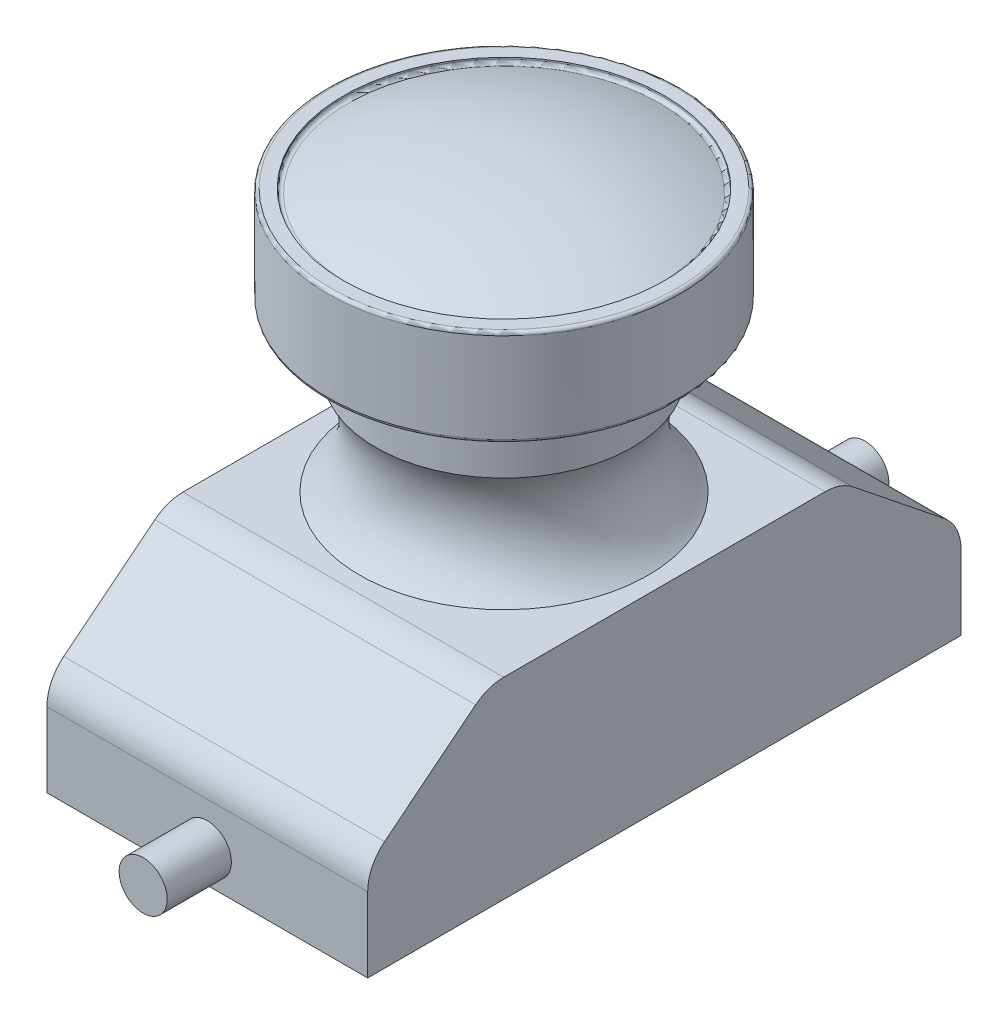
from build123d import *

# Parameters (mm, degrees)
BOSS_EXTRUDE1_DEPTH = 5
FILLET1_R           = 0.1
FILLET2_R           = 0.1
FILLET3_R           = 1.4
SKETCH4_R           = 0.75
BOSS_EXTRUDE2_DEPTH = 2


with BuildPart() as part:
    # Sketch1 → Boss-Extrude1 (new, symmetric)
    with BuildSketch(Plane(origin=(0, 0, 0), x_dir=(0, 0, -1), z_dir=(1, 0, 0))):
        Polygon((-9.25, 0), (9.25, 0), (9.25, 3), (5.5, 6), (-5.5, 6), (-9.25, 3), align=None)
    extrude(amount=BOSS_EXTRUDE1_DEPTH, both=True)

    # Sketch2 → Revolve1 (revolve)
    with BuildSketch(Plane(origin=(0, 0, 0), x_dir=(0, 0, -1), z_dir=(1, 0, 0))):
        with BuildLine():
            Line((0, 6), (0, 14))
            Line((0, 14), (5, 14))
            Line((5, 14), (5, 14.2))
            Line((5, 14.2), (5.5, 14.2))
            Line((5.5, 14.2), (5.5, 11.2))
            Line((5.5, 11.2), (4, 11.2))
            Line((4, 11.2), (4, 9.2))
            ThreePointArc((4, 9.2), (3.661737334, 7.508083958), (4.5, 6))
            Line((4.5, 6), (0, 6))
        make_face()
    revolve(axis=Axis((0, 6, 0), (0, 1, 0)))

    # Sketch3 → Revolve2 (revolve)
    with BuildSketch(Plane(origin=(0, 0, 0), x_dir=(0, 0, -1), z_dir=(1, 0, 0))):
        with BuildLine():
            Line((0, 14.2), (0, 15))
            ThreePointArc((0, 15), (-2.553728094, 14.768640471), (-5, 14))
            Line((-5, 14), (0, 14))
            Line((0, 14), (0, 14.2))
        make_face()
    revolve(axis=Axis((0, 14.2, 0), (0, 1, 0)))

    # Fillet1
    fillet1_edges = [part.edges().sort_by_distance(p)[0] for p in [
        (0, 11.2, 5.5),
        (0, 14.2, 5.5),
    ]]
    fillet(fillet1_edges, radius=FILLET1_R)

    # Fillet2
    fillet2_edges = [part.edges().sort_by_distance(p)[0] for p in [
        (5, 14, 0),
    ]]
    fillet(fillet2_edges, radius=FILLET2_R)

    # Fillet3
    fillet3_edges = [part.edges().sort_by_distance(p)[0] for p in [
        (0, 3, 9.25),
        (0, 6, 5.5),
        (0, 6, -5.5),
        (0, 3, -9.25),
    ]]
    fillet(fillet3_edges, radius=FILLET3_R)

    # Sketch4 → Boss-Extrude2 (add)
    with BuildSketch(Plane(origin=(0, 0, -9.25), x_dir=(-1, 0, 0), z_dir=(0, 0, -1))):
        with Locations(Location((0, 1, 0), (0, 0, 180))):
            Circle(SKETCH4_R)
    boss_extrude2 = extrude(amount=BOSS_EXTRUDE2_DEPTH)

    # Mirror1: Boss-Extrude2 across plane
    add(boss_extrude2.mirror(Plane.XY))


solid = part.part
